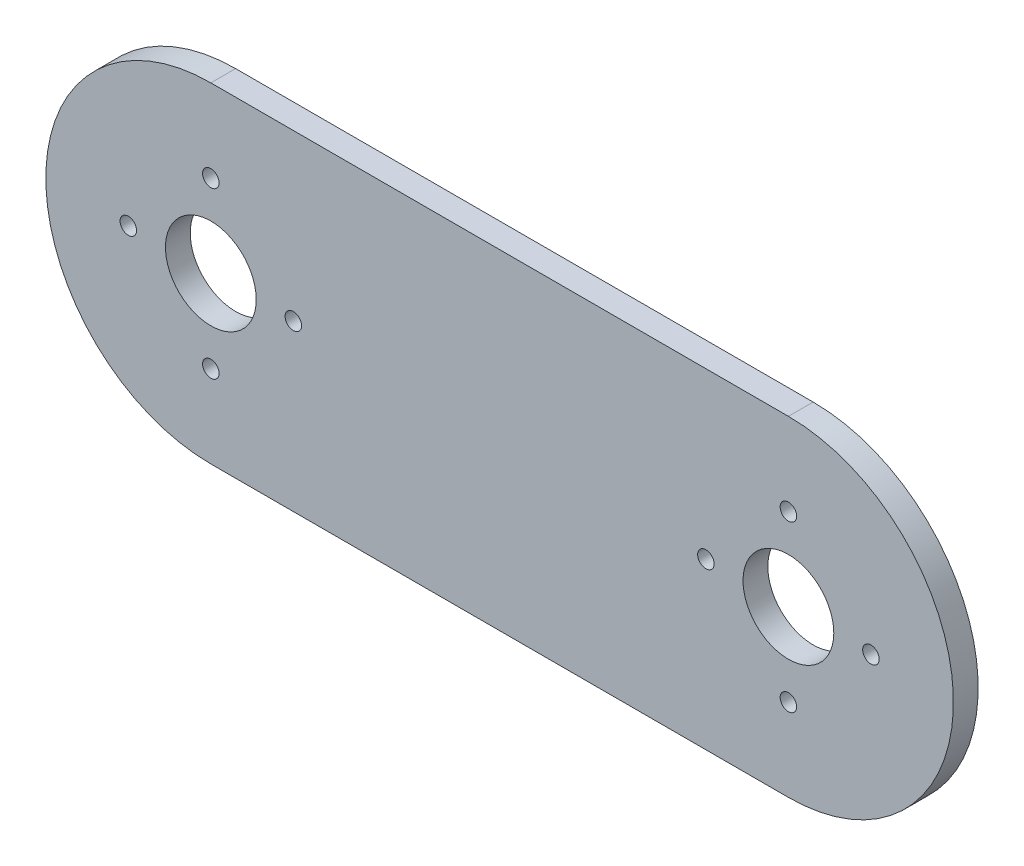
from build123d import *

# Parameters (mm, degrees)
SKETCH1_R           = 1
SKETCH1_R_2         = 5.5
BOSS_EXTRUDE1_DEPTH = 3


with BuildPart() as part:
    # Sketch1 → Boss-Extrude1 (new body)
    with BuildSketch(Plane.XY):
        with BuildLine():
            Line((0, 20), (70, 20))
            ThreePointArc((70, 20), (90, 0), (70, -20))
            Line((70, -20), (0, -20))
            ThreePointArc((0, -20), (-20, 0), (0, 20))
        make_face()
        with Locations((10, 0)):
            Circle(SKETCH1_R, mode=Mode.SUBTRACT)
        with Locations((0, -10)):
            Circle(SKETCH1_R, mode=Mode.SUBTRACT)
        with Locations((-10, 0)):
            Circle(SKETCH1_R, mode=Mode.SUBTRACT)
        with Locations((0, 10)):
            Circle(SKETCH1_R, mode=Mode.SUBTRACT)
        with Locations((80, 0)):
            Circle(SKETCH1_R, mode=Mode.SUBTRACT)
        with Locations((60, 0)):
            Circle(SKETCH1_R, mode=Mode.SUBTRACT)
        with Locations((70, 10)):
            Circle(SKETCH1_R, mode=Mode.SUBTRACT)
        with Locations((70, -10)):
            Circle(SKETCH1_R, mode=Mode.SUBTRACT)
        Circle(SKETCH1_R_2, mode=Mode.SUBTRACT)
        with Locations((70, 0)):
            Circle(SKETCH1_R_2, mode=Mode.SUBTRACT)
    extrude(amount=BOSS_EXTRUDE1_DEPTH)


solid = part.part
